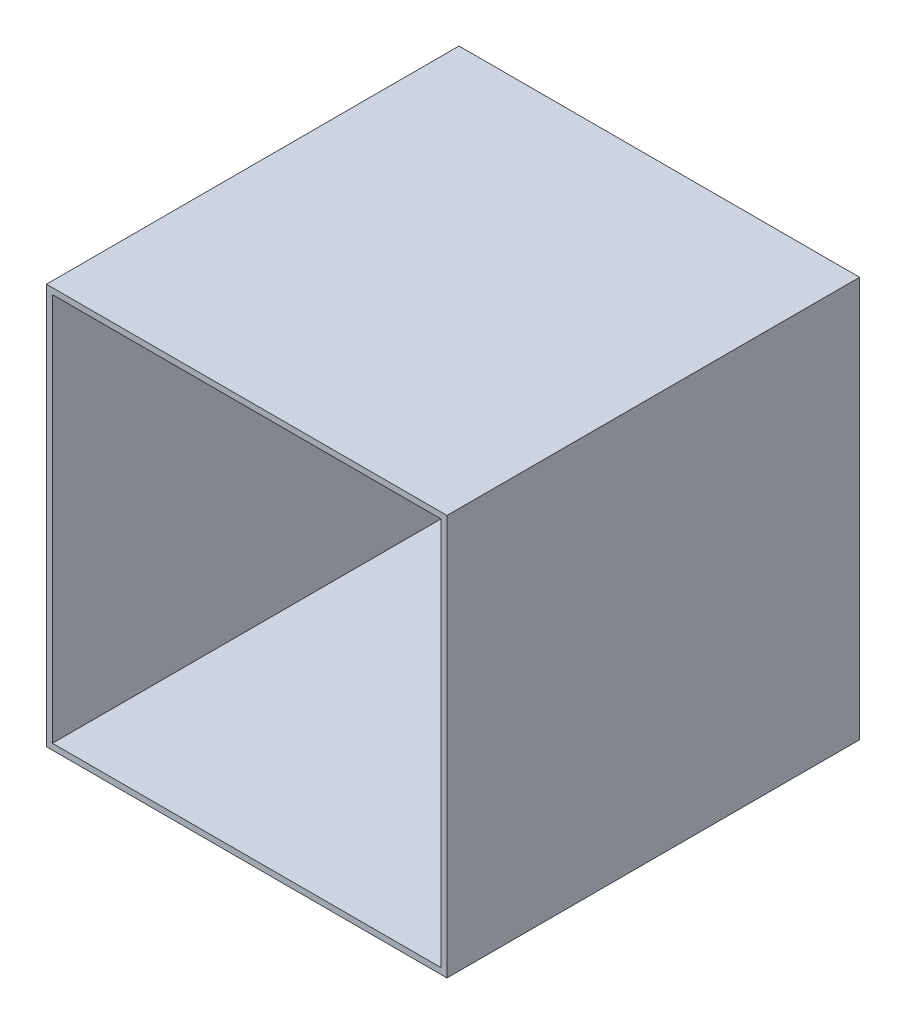
from build123d import *

# Parameters (mm, degrees)
SKETCH1_W           = 100
SKETCH1_H           = 100
BOSS_EXTRUDE1_DEPTH = 3
SKETCH4_W           = 100
SKETCH4_H           = 100
BOSS_EXTRUDE2_DEPTH = 100
SKETCH5_W           = 97
SKETCH5_H           = 97
CUT_EXTRUDE1_DEPTH  = 100
SKETCH6_R           = 1
CUT_EXTRUDE2_DEPTH  = 3
SKETCH7_W           = 18.8
SKETCH7_H           = 13.7
CUT_EXTRUDE3_DEPTH  = 3
CUT_EXTRUDE4_DEPTH  = 3


with BuildPart() as part:
    # Sketch1 → Boss-Extrude1 (new body)
    with BuildSketch(Plane(origin=(0, 0, 0), x_dir=(0, 1, 0), z_dir=(0, 0, 1))):
        Rectangle(SKETCH1_W, SKETCH1_H)
    extrude(amount=BOSS_EXTRUDE1_DEPTH)

    # Sketch4 → Boss-Extrude2 (add)
    with BuildSketch(Plane.XY.offset(3)):
        Rectangle(SKETCH4_W, SKETCH4_H)
    extrude(amount=BOSS_EXTRUDE2_DEPTH)

    # Sketch5 → Cut-Extrude1 (cut)
    with BuildSketch(Plane.XY.offset(103)):
        Rectangle(SKETCH5_W, SKETCH5_H)
    extrude(amount=-CUT_EXTRUDE1_DEPTH, mode=Mode.SUBTRACT)

    # Sketch6 → Cut-Extrude2 (cut)
    with BuildSketch(Plane.XZ.offset(50)):
        with Locations(Location((-45.693823315, 4.571208487, 0), (0, 0, 270))):
            Circle(SKETCH6_R)
        with Locations(Location((-38.438385154, 4.571208487, 0), (0, 0, 270))):
            Circle(SKETCH6_R)
        with Locations(Location((-29.79360777, 4.571208487, 0), (0, 0, 270))):
            Circle(SKETCH6_R)
    extrude(amount=-CUT_EXTRUDE2_DEPTH, mode=Mode.SUBTRACT)

    # Sketch7 → Cut-Extrude3 (cut)
    with BuildSketch(Plane.XZ.offset(50)):
        with Locations((-3.258424026, 11.15)):
            Rectangle(SKETCH7_W, SKETCH7_H)
    extrude(amount=-CUT_EXTRUDE3_DEPTH, mode=Mode.SUBTRACT)

    # Sketch8 → Cut-Extrude4 (cut)
    with BuildSketch(Plane.XZ.offset(50)):
        with BuildLine():
            Line((19.795752189, 9), (26.855752189, 9))
            ThreePointArc((26.855752189, 9), (28.135752189, 7.72), (26.855752189, 6.44))
            Line((26.855752189, 6.44), (19.795752189, 6.44))
            ThreePointArc((19.795752189, 6.44), (18.515752189, 7.72), (19.795752189, 9))
        make_face()
    extrude(amount=-CUT_EXTRUDE4_DEPTH, mode=Mode.SUBTRACT)


solid = part.part
